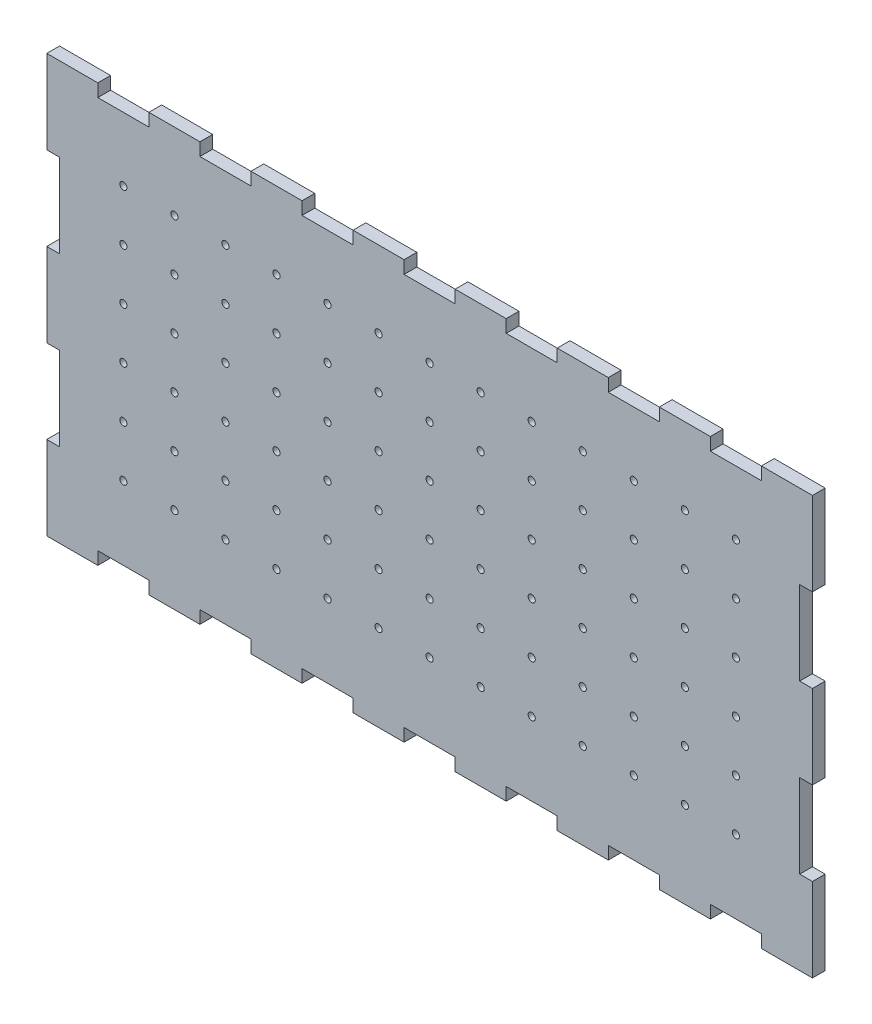
from build123d import *

# Parameters (mm, degrees)
SKETCH1_W            = 381
SKETCH1_H            = 207.9625
BOSS_EXTRUDE1_DEPTH  = 6.35
SKETCH2_W            = 25.4
SKETCH2_H            = 6.35
CUT_EXTRUDE1_DEPTH   = 6.35
LPATTERN1_COUNT      = 7
LPATTERN1_PITCH      = 50.8
SKETCH3_W            = 6.35
SKETCH3_H            = 41.5925
CUT_EXTRUDE2_DEPTH   = 6.35
LPATTERN2_COUNT      = 2
LPATTERN2_PITCH      = 83.185
SKETCH5_W            = 25.4
SKETCH5_H            = 6.35
CUT_EXTRUDE3_DEPTH   = 6.35
LPATTERN3_COUNT      = 7
LPATTERN3_PITCH      = 50.8
SKETCH6_W            = 6.35
SKETCH6_H            = 41.5925
CUT_EXTRUDE4_DEPTH   = 6.35
LPATTERN4_COUNT      = 2
LPATTERN4_PITCH      = 83.185
SKETCH7_R            = 1.778
CUT_EXTRUDE5_DEPTH   = 6.35
LPATTERN5_COUNT      = 13
LPATTERN5_PITCH      = 25.4
LPATTERN5_COUNT_DIR2 = 6
LPATTERN5_PITCH_DIR2 = 25.4


with BuildPart() as part:
    # Sketch1 → Boss-Extrude1 (new body)
    with BuildSketch(Plane.XY):
        Rectangle(SKETCH1_W, SKETCH1_H)
    extrude(amount=BOSS_EXTRUDE1_DEPTH)

    # Sketch2 → Cut-Extrude1 (cut)
    with BuildSketch(Plane.XY.offset(6.35)):
        with Locations((-152.4, 100.80625)):
            Rectangle(SKETCH2_W, SKETCH2_H)
    cut_extrude1 = extrude(amount=-CUT_EXTRUDE1_DEPTH, mode=Mode.SUBTRACT)

    # LPattern1: Cut-Extrude1 ×7
    with Locations(*[(i * LPATTERN1_PITCH, 0, 0) for i in range(1, LPATTERN1_COUNT)]):
        add(cut_extrude1, mode=Mode.SUBTRACT)

    # Sketch3 → Cut-Extrude2 (cut)
    with BuildSketch(Plane.XY.offset(6.35)):
        with Locations((-187.325, 41.5925)):
            Rectangle(SKETCH3_W, SKETCH3_H)
    cut_extrude2 = extrude(amount=-CUT_EXTRUDE2_DEPTH, mode=Mode.SUBTRACT)

    # LPattern2: Cut-Extrude2 ×2
    with Locations(*[(0, -i * LPATTERN2_PITCH, 0) for i in range(1, LPATTERN2_COUNT)]):
        add(cut_extrude2, mode=Mode.SUBTRACT)

    # Sketch5 → Cut-Extrude3 (cut)
    with BuildSketch(Plane.XY.offset(6.35)):
        with Locations((-152.4, -100.80625)):
            Rectangle(SKETCH5_W, SKETCH5_H)
    cut_extrude3 = extrude(amount=-CUT_EXTRUDE3_DEPTH, mode=Mode.SUBTRACT)

    # LPattern3: Cut-Extrude3 ×7
    with Locations(*[(i * LPATTERN3_PITCH, 0, 0) for i in range(1, LPATTERN3_COUNT)]):
        add(cut_extrude3, mode=Mode.SUBTRACT)

    # Sketch6 → Cut-Extrude4 (cut)
    with BuildSketch(Plane.XY.offset(6.35)):
        with Locations((187.325, 41.5925)):
            Rectangle(SKETCH6_W, SKETCH6_H)
    cut_extrude4 = extrude(amount=-CUT_EXTRUDE4_DEPTH, mode=Mode.SUBTRACT)

    # LPattern4: Cut-Extrude4 ×2
    with Locations(*[(0, -i * LPATTERN4_PITCH, 0) for i in range(1, LPATTERN4_COUNT)]):
        add(cut_extrude4, mode=Mode.SUBTRACT)

    # Sketch7 → Cut-Extrude5 (cut)
    with BuildSketch(Plane.XY.offset(6.35)):
        with Locations((-152.4, 65.88125)):
            Circle(SKETCH7_R)
    cut_extrude5 = extrude(amount=-CUT_EXTRUDE5_DEPTH, mode=Mode.SUBTRACT)

    # LPattern5: Cut-Extrude5 13 × 6
    with Locations(*[(i * LPATTERN5_PITCH, -j * LPATTERN5_PITCH_DIR2, 0) for i in range(LPATTERN5_COUNT) for j in range(LPATTERN5_COUNT_DIR2) if (i, j) != (0, 0)]):
        add(cut_extrude5, mode=Mode.SUBTRACT)


solid = part.part
